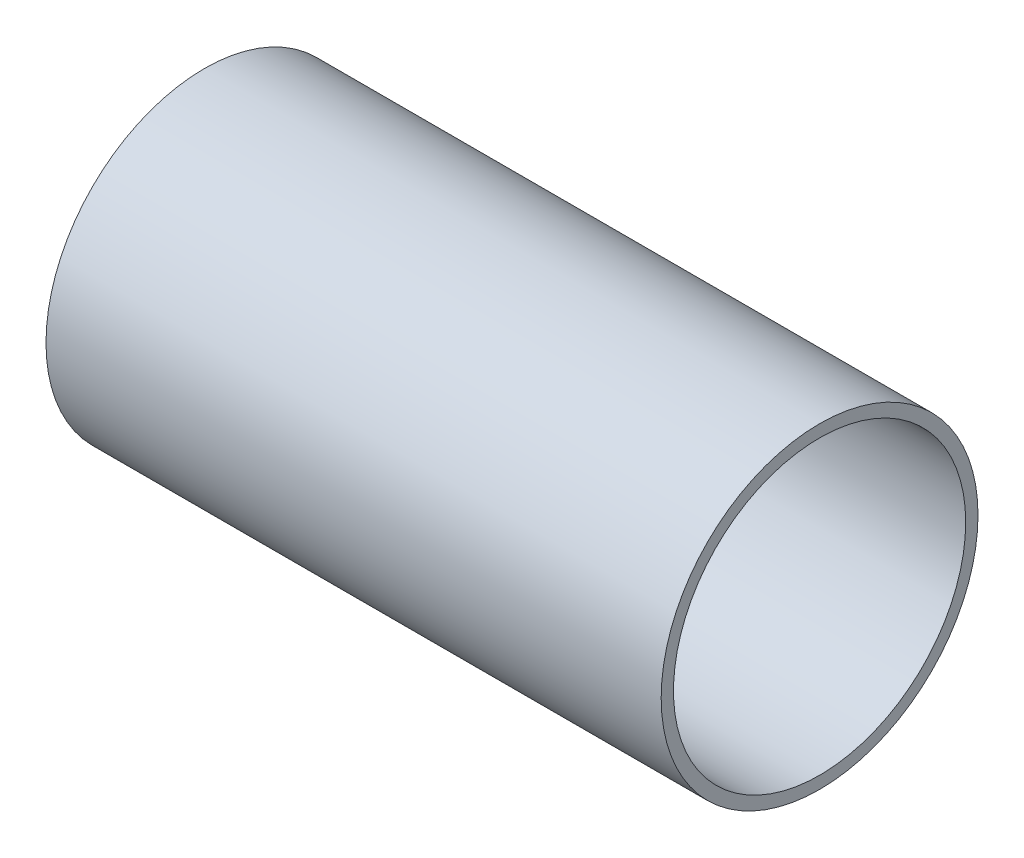
from build123d import *

# Parameters (mm, degrees)
ESQUISSE1_R        = 51.5
ESQUISSE1_R_2      = 47.5
BOSS_EXTRU_1_DEPTH = 200


with BuildPart() as part:
    # Esquisse1 → Boss.-Extru.1 (new body)
    with BuildSketch(Plane(origin=(0, 0, 0), x_dir=(0, 0, -1), z_dir=(1, 0, 0))):
        Circle(ESQUISSE1_R)
        Circle(ESQUISSE1_R_2, mode=Mode.SUBTRACT)
    extrude(amount=BOSS_EXTRU_1_DEPTH)


solid = part.part
